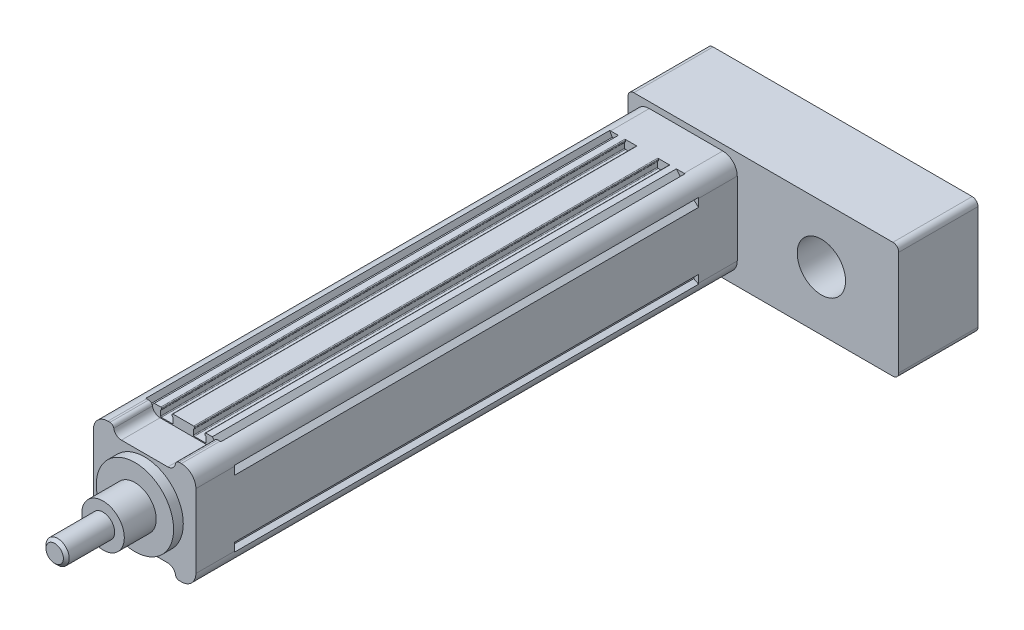
from build123d import *

# Parameters (mm, degrees)
SKETCH_1_R                  = 2.1
EXTRUDE_1_DEPTH             = 240
EXTRUDE_2_DEPTH             = 20
SKETCH_7_R                  = 20
EXTRUDE_3_DEPTH             = 5
SKETCH_9_R                  = 11
EXTRUDE_4_DEPTH             = 16.5
SKETCH_10_R                 = 6
EXTRUDE_5_DEPTH             = 25
EXTRUDE_START               = 20
EXTRUDE_6_DEPTH             = 20
EXTRUDE_7_DEPTH             = 41
SKETCH_13_R                 = 12.5
CUT_EXTRUDE_2_DEPTH         = 30
PATTERN_LINEAR_1_COUNT      = 2
PATTERN_LINEAR_1_PITCH      = 38
PATTERN_LINEAR_1_COUNT_DIR2 = 2
PATTERN_LINEAR_1_PITCH_DIR2 = 38
HOLE_WIZARD_M6_2_D          = 5
HOLE_WIZARD_M6_2_DEPTH      = 15
HOLE_WIZARD_M6_2_TIP        = 1.502151548
HOLE_WIZARD_M6_3_D          = 5
HOLE_WIZARD_M6_3_DEPTH      = 15
HOLE_WIZARD_M6_3_TIP        = 1.502151548
HOLE_WIZARD_M6_4_D          = 5
HOLE_WIZARD_M6_4_DEPTH      = 15
HOLE_WIZARD_M6_4_TIP        = 1.502151548
CHAMFER_1_SIZE              = 1.5


with BuildPart() as part:
    # 草图1 → 凸台-拉伸1 (new body)
    with BuildSketch(Plane.XY):
        with BuildLine():
            Line((-18.2, 24), (-19.443439638, 26.486879276))
            ThreePointArc((-19.443439638, 26.486879276), (-24.303300859, 24.303300859), (-26.486879276, 19.443439638))
            Line((-26.486879276, 19.443439638), (-24, 18.2))
            Line((-24, 18.2), (-24, 17.1))
            Line((-24, 17.1), (-26.5, 15))
            Line((-26.5, 15), (-26.5, -15))
            Line((-26.5, -15), (-24, -17.1))
            Line((-24, -17.1), (-24, -18.2))
            Line((-24, -18.2), (-26.486879276, -19.443439638))
            ThreePointArc((-26.486879276, -19.443439638), (-24.303300859, -24.303300859), (-19.443439638, -26.486879276))
            Line((-19.443439638, -26.486879276), (-18.2, -24))
            Line((-18.2, -24), (-17.1, -24))
            Line((-17.1, -24), (-15, -26.5))
            Line((-15, -26.5), (-11.65, -26.5))
            ThreePointArc((-11.65, -26.5), (-11.367157288, -26.382842712), (-11.25, -26.1))
            Line((-11.25, -26.1), (-11.25, -25.6))
            ThreePointArc((-11.25, -25.6), (-11.367157288, -25.317157288), (-11.65, -25.2))
            Line((-11.65, -25.2), (-11.75, -25.2))
            Line((-11.75, -25.2), (-11.75, -22.4))
            ThreePointArc((-11.75, -22.4), (-11.632842712, -22.117157288), (-11.35, -22))
            Line((-11.35, -22), (-5.65, -22))
            ThreePointArc((-5.65, -22), (-5.367157288, -22.117157288), (-5.25, -22.4))
            Line((-5.25, -22.4), (-5.25, -25.2))
            Line((-5.25, -25.2), (-5.35, -25.2))
            ThreePointArc((-5.35, -25.2), (-5.632842712, -25.317157288), (-5.75, -25.6))
            Line((-5.75, -25.6), (-5.75, -26.1))
            ThreePointArc((-5.75, -26.1), (-5.632842712, -26.382842712), (-5.35, -26.5))
            Line((-5.35, -26.5), (5.35, -26.5))
            ThreePointArc((5.35, -26.5), (5.632842712, -26.382842712), (5.75, -26.1))
            Line((5.75, -26.1), (5.75, -25.6))
            ThreePointArc((5.75, -25.6), (5.632842712, -25.317157288), (5.35, -25.2))
            Line((5.35, -25.2), (5.25, -25.2))
            Line((5.25, -25.2), (5.25, -22.4))
            ThreePointArc((5.25, -22.4), (5.367157288, -22.117157288), (5.65, -22))
            Line((5.65, -22), (11.35, -22))
            ThreePointArc((11.35, -22), (11.632842712, -22.117157288), (11.75, -22.4))
            Line((11.75, -22.4), (11.75, -25.2))
            Line((11.75, -25.2), (11.65, -25.2))
            ThreePointArc((11.65, -25.2), (11.367157288, -25.317157288), (11.25, -25.6))
            Line((11.25, -25.6), (11.25, -26.1))
            ThreePointArc((11.25, -26.1), (11.367157288, -26.382842712), (11.65, -26.5))
            Line((11.65, -26.5), (15, -26.5))
            Line((15, -26.5), (17.1, -24))
            Line((17.1, -24), (18.2, -24))
            Line((18.2, -24), (19.443439638, -26.486879276))
            ThreePointArc((19.443439638, -26.486879276), (24.303300859, -24.303300859), (26.486879276, -19.443439638))
            Line((26.486879276, -19.443439638), (24, -18.2))
            Line((24, -18.2), (24, -17.1))
            Line((24, -17.1), (26.5, -15))
            Line((26.5, -15), (26.5, 15))
            Line((26.5, 15), (24, 17.1))
            Line((24, 17.1), (24, 18.2))
            Line((24, 18.2), (26.486879276, 19.443439638))
            ThreePointArc((26.486879276, 19.443439638), (24.303300859, 24.303300859), (19.443439638, 26.486879276))
            Line((19.443439638, 26.486879276), (18.2, 24))
            Line((18.2, 24), (17.1, 24))
            Line((17.1, 24), (15, 26.5))
            Line((15, 26.5), (11.65, 26.5))
            ThreePointArc((11.65, 26.5), (11.367157288, 26.382842712), (11.25, 26.1))
            Line((11.25, 26.1), (11.25, 25.6))
            ThreePointArc((11.25, 25.6), (11.367157288, 25.317157288), (11.65, 25.2))
            Line((11.65, 25.2), (11.75, 25.2))
            Line((11.75, 25.2), (11.75, 22.4))
            ThreePointArc((11.75, 22.4), (11.632842712, 22.117157288), (11.35, 22))
            Line((11.35, 22), (5.65, 22))
            ThreePointArc((5.65, 22), (5.367157288, 22.117157288), (5.25, 22.4))
            Line((5.25, 22.4), (5.25, 25.2))
            Line((5.25, 25.2), (5.35, 25.2))
            ThreePointArc((5.35, 25.2), (5.632842712, 25.317157288), (5.75, 25.6))
            Line((5.75, 25.6), (5.75, 26.1))
            ThreePointArc((5.75, 26.1), (5.632842712, 26.382842712), (5.35, 26.5))
            Line((5.35, 26.5), (-5.35, 26.5))
            ThreePointArc((-5.35, 26.5), (-5.632842712, 26.382842712), (-5.75, 26.1))
            Line((-5.75, 26.1), (-5.75, 25.6))
            ThreePointArc((-5.75, 25.6), (-5.632842712, 25.317157288), (-5.35, 25.2))
            Line((-5.35, 25.2), (-5.25, 25.2))
            Line((-5.25, 25.2), (-5.25, 22.4))
            ThreePointArc((-5.25, 22.4), (-5.367157288, 22.117157288), (-5.65, 22))
            Line((-5.65, 22), (-11.35, 22))
            ThreePointArc((-11.35, 22), (-11.632842712, 22.117157288), (-11.75, 22.4))
            Line((-11.75, 22.4), (-11.75, 25.2))
            Line((-11.75, 25.2), (-11.65, 25.2))
            ThreePointArc((-11.65, 25.2), (-11.367157288, 25.317157288), (-11.25, 25.6))
            Line((-11.25, 25.6), (-11.25, 26.1))
            ThreePointArc((-11.25, 26.1), (-11.367157288, 26.382842712), (-11.65, 26.5))
            Line((-11.65, 26.5), (-15, 26.5))
            Line((-15, 26.5), (-17.1, 24))
            Line((-17.1, 24), (-18.2, 24))
        make_face()
        with Locations((19, 19)):
            Circle(SKETCH_1_R, mode=Mode.SUBTRACT)
        with Locations((19, -19)):
            Circle(SKETCH_1_R, mode=Mode.SUBTRACT)
        with Locations((-19, -19)):
            Circle(SKETCH_1_R, mode=Mode.SUBTRACT)
        with Locations((-19, 19)):
            Circle(SKETCH_1_R, mode=Mode.SUBTRACT)
        with BuildLine():
            Line((19.773719933, 3), (23.3, 3))
            Line((23.3, 3), (23.3, -3))
            Line((23.3, -3), (19.773719933, -3))
            ThreePointArc((19.773719933, -3), (0, -20), (-19.773719933, -3))
            Line((-19.773719933, -3), (-23.3, -3))
            Line((-23.3, -3), (-23.3, 3))
            Line((-23.3, 3), (-19.773719933, 3))
            ThreePointArc((-19.773719933, 3), (0, 20), (19.773719933, 3))
        make_face(mode=Mode.SUBTRACT)
    extrude(amount=EXTRUDE_1_DEPTH)

    # 草图6 → 凸台-拉伸2 (add)
    with BuildSketch(Plane.XY.offset(240)):
        with BuildLine():
            Line((-26.5, -19), (-26.5, 19))
            ThreePointArc((-26.5, 19), (-24.303300859, 24.303300859), (-19, 26.5))
            Line((-19, 26.5), (-17.916079783, 26.5))
            ThreePointArc((-17.916079783, 26.5), (-16.625085334, 26.027525232), (-15.944053189, 24.833333333))
            ThreePointArc((-15.944053189, 24.833333333), (-14.581988897, 22.444949537), (-12, 21.5))
            Line((-12, 21.5), (12, 21.5))
            ThreePointArc((12, 21.5), (14.581988897, 22.444949537), (15.944053189, 24.833333333))
            ThreePointArc((15.944053189, 24.833333333), (16.625085334, 26.027525232), (17.916079783, 26.5))
            Line((17.916079783, 26.5), (19, 26.5))
            ThreePointArc((19, 26.5), (24.303300859, 24.303300859), (26.5, 19))
            Line((26.5, 19), (26.5, -19))
            ThreePointArc((26.5, -19), (24.303300859, -24.303300859), (19, -26.5))
            Line((19, -26.5), (17.916079783, -26.5))
            ThreePointArc((17.916079783, -26.5), (16.625085334, -26.027525232), (15.944053189, -24.833333333))
            ThreePointArc((15.944053189, -24.833333333), (14.581988897, -22.444949537), (12, -21.5))
            Line((12, -21.5), (-12, -21.5))
            ThreePointArc((-12, -21.5), (-14.581988897, -22.444949537), (-15.944053189, -24.833333333))
            ThreePointArc((-15.944053189, -24.833333333), (-16.625085334, -26.027525232), (-17.916079783, -26.5))
            Line((-17.916079783, -26.5), (-19, -26.5))
            ThreePointArc((-19, -26.5), (-24.303300859, -24.303300859), (-26.5, -19))
        make_face()
    extrude(amount=EXTRUDE_2_DEPTH)

    # 草图7 → 凸台-拉伸3 (add)
    with BuildSketch(Plane.XY.offset(260)):
        Circle(SKETCH_7_R)
    extrude(amount=EXTRUDE_3_DEPTH)

    # 草图9 → 凸台-拉伸4 (add)
    with BuildSketch(Plane.XY.offset(265)):
        Circle(SKETCH_9_R)
    extrude(amount=EXTRUDE_4_DEPTH)

    # 草图10 → 凸台-拉伸5 (add)
    with BuildSketch(Plane.XY.offset(281.5)):
        Circle(SKETCH_10_R)
    extrude(amount=EXTRUDE_5_DEPTH)

    # 草图11 → 凸台-拉伸6 (add)
    with BuildSketch(Plane(origin=(0, 0, 0), x_dir=(-1, 0, 0), z_dir=(0, 0, -1)).offset(EXTRUDE_START)):
        with BuildLine():
            Line((-19, -26.5), (19, -26.5))
            ThreePointArc((19, -26.5), (24.303300859, -24.303300859), (26.5, -19))
            Line((26.5, -19), (26.5, 19))
            ThreePointArc((26.5, 19), (24.303300859, 24.303300859), (19, 26.5))
            Line((19, 26.5), (-19, 26.5))
            ThreePointArc((-19, 26.5), (-24.303300859, 24.303300859), (-26.5, 19))
            Line((-26.5, 19), (-26.5, -19))
            ThreePointArc((-26.5, -19), (-24.303300859, -24.303300859), (-19, -26.5))
        make_face()
    extrude(amount=-EXTRUDE_6_DEPTH)

    # 草图12 → 凸台-拉伸7 (add)
    with BuildSketch(Plane(origin=(0, 0, -20), x_dir=(-1, 0, 0), z_dir=(0, 0, -1))):
        with BuildLine():
            Line((-107, -30.404162038), (27, -30.404162038))
            ThreePointArc((27, -30.404162038), (29.121320344, -29.525482382), (30, -27.404162038))
            Line((30, -27.404162038), (30, 26.595837962))
            ThreePointArc((30, 26.595837962), (29.121320344, 28.717158305), (27, 29.595837962))
            Line((27, 29.595837962), (-107, 29.595837962))
            ThreePointArc((-107, 29.595837962), (-109.121320344, 28.717158305), (-110, 26.595837962))
            Line((-110, 26.595837962), (-110, -27.404162038))
            ThreePointArc((-110, -27.404162038), (-109.121320344, -29.525482382), (-107, -30.404162038))
        make_face()
    extrude(amount=EXTRUDE_7_DEPTH)

    # 草图13 → 切除-拉伸2 (cut)
    with BuildSketch(Plane.XY.offset(-20)):
        with Locations((70, 0)):
            Circle(SKETCH_13_R)
    extrude(amount=-CUT_EXTRUDE_2_DEPTH, mode=Mode.SUBTRACT)

    # 草图15 → M6 螺纹孔1 (revolve, cut)
    with BuildSketch(Plane(origin=(-19, -19, -61), x_dir=(0, 1, 0), z_dir=(1, 0, 0))):
        Polygon((0, 0), (0, 16.502151548), (2.5, 15), (2.5, 0), align=None)
    hole_wizard_m6_1 = revolve(axis=Axis((-19, -19, -67.35), (0, 0, 1)), mode=Mode.SUBTRACT)

    # 阵列(线性)1: Hole Wizard M6 _1 2 × 2
    with Locations(*[(j * PATTERN_LINEAR_1_PITCH_DIR2, i * PATTERN_LINEAR_1_PITCH, 0) for i in range(PATTERN_LINEAR_1_COUNT) for j in range(PATTERN_LINEAR_1_COUNT_DIR2) if (i, j) != (0, 0)]):
        add(hole_wizard_m6_1, mode=Mode.SUBTRACT)

    # M6 螺纹孔2
    with Locations(Plane(origin=(0, 0, -61), x_dir=(-1, 0, 0), z_dir=(0, 0, -1))):
        with Locations((-84, -19), (-84, 19)):
            Hole(HOLE_WIZARD_M6_2_D / 2, depth=HOLE_WIZARD_M6_2_DEPTH)
            with Locations((0, 0, -(HOLE_WIZARD_M6_2_DEPTH + HOLE_WIZARD_M6_2_TIP / 2))):  # 118° drill point
                Cone(0, HOLE_WIZARD_M6_2_D / 2, HOLE_WIZARD_M6_2_TIP, mode=Mode.SUBTRACT)

    # M6 螺纹孔3
    with Locations(Plane.ZY.offset(26.5)):
        with Locations((250, 11), (250, -11)):
            Hole(HOLE_WIZARD_M6_3_D / 2, depth=HOLE_WIZARD_M6_3_DEPTH)
            with Locations((0, 0, -(HOLE_WIZARD_M6_3_DEPTH + HOLE_WIZARD_M6_3_TIP / 2))):  # 118° drill point
                Cone(0, HOLE_WIZARD_M6_3_D / 2, HOLE_WIZARD_M6_3_TIP, mode=Mode.SUBTRACT)

    # M6 螺纹孔4
    with Locations(Plane.ZY.offset(26.5)):
        with Locations((-10, 11), (-10, -11)):
            Hole(HOLE_WIZARD_M6_4_D / 2, depth=HOLE_WIZARD_M6_4_DEPTH)
            with Locations((0, 0, -(HOLE_WIZARD_M6_4_DEPTH + HOLE_WIZARD_M6_4_TIP / 2))):  # 118° drill point
                Cone(0, HOLE_WIZARD_M6_4_D / 2, HOLE_WIZARD_M6_4_TIP, mode=Mode.SUBTRACT)

    # 倒角1
    chamfer_1_edges = [part.edges().sort_by_distance(p)[0] for p in [
        (-6, 0, 306.5),
    ]]
    chamfer(chamfer_1_edges, length=CHAMFER_1_SIZE)


solid = part.part
